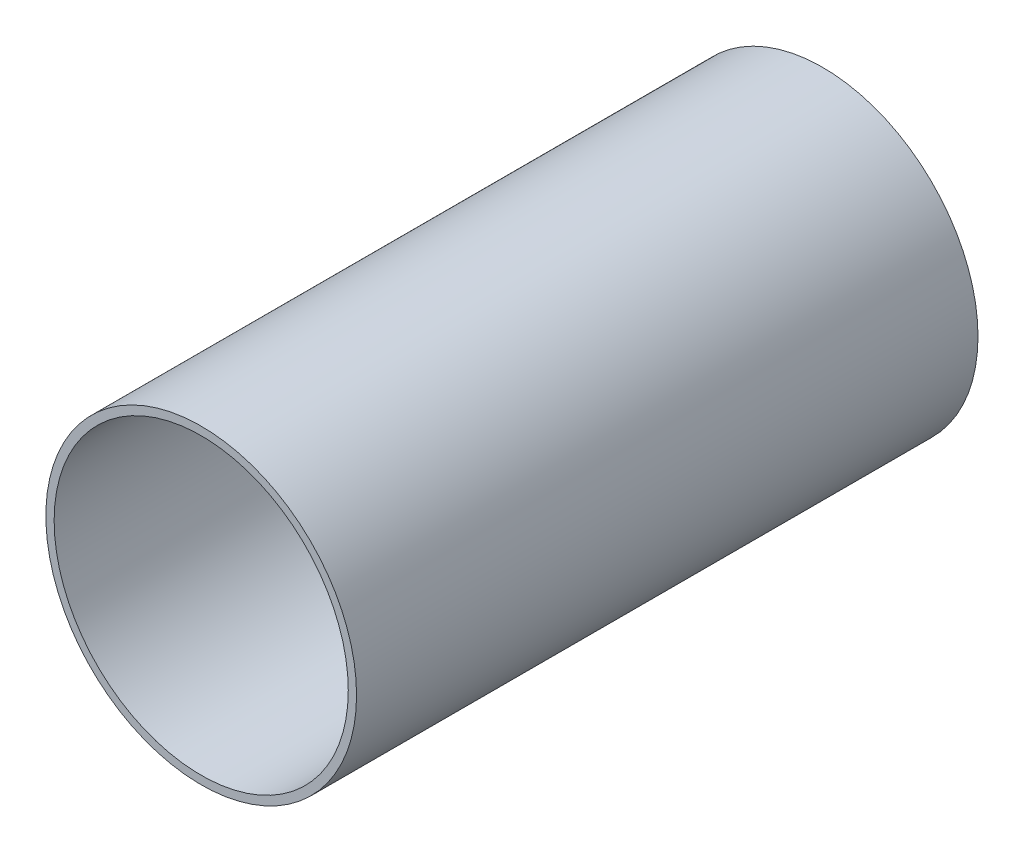
from build123d import *

# Parameters (mm, degrees)
SKETCH1_R           = 37.5
SKETCH1_R_2         = 35.5
BOSS_EXTRUDE1_DEPTH = 150


with BuildPart() as part:
    # Sketch1 → Boss-Extrude1 (new body)
    with BuildSketch(Plane.XY):
        with Locations((-54.780680451, 32.395681586)):
            Circle(SKETCH1_R)
        with Locations((-54.780680451, 32.395681586)):
            Circle(SKETCH1_R_2, mode=Mode.SUBTRACT)
    extrude(amount=BOSS_EXTRUDE1_DEPTH)


solid = part.part
